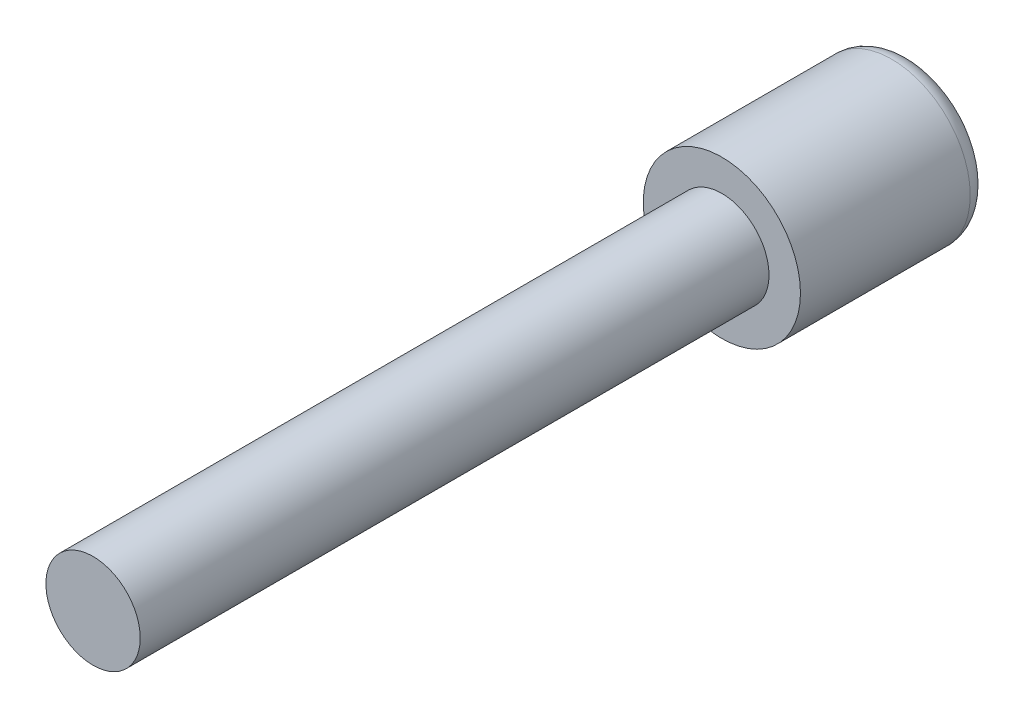
from build123d import *

# Parameters (mm, degrees)
SKETCH1_R           = 1.25
BOSS_EXTRUDE1_DEPTH = 3
SKETCH2_R           = 0.75
BOSS_EXTRUDE2_DEPTH = 10
FILLET2_R           = 0.3


with BuildPart() as part:
    # Sketch1 → Boss-Extrude1 (new body)
    with BuildSketch(Plane.XY):
        Circle(SKETCH1_R)
    extrude(amount=BOSS_EXTRUDE1_DEPTH)

    # Sketch2 → Boss-Extrude2 (add)
    with BuildSketch(Plane.XY.offset(3)):
        Circle(SKETCH2_R)
    extrude(amount=BOSS_EXTRUDE2_DEPTH)

    # Fillet2
    fillet2_edges = [part.edges().sort_by_distance(p)[0] for p in [
        (-1.25, 0, 0),
    ]]
    fillet(fillet2_edges, radius=FILLET2_R)


solid = part.part
